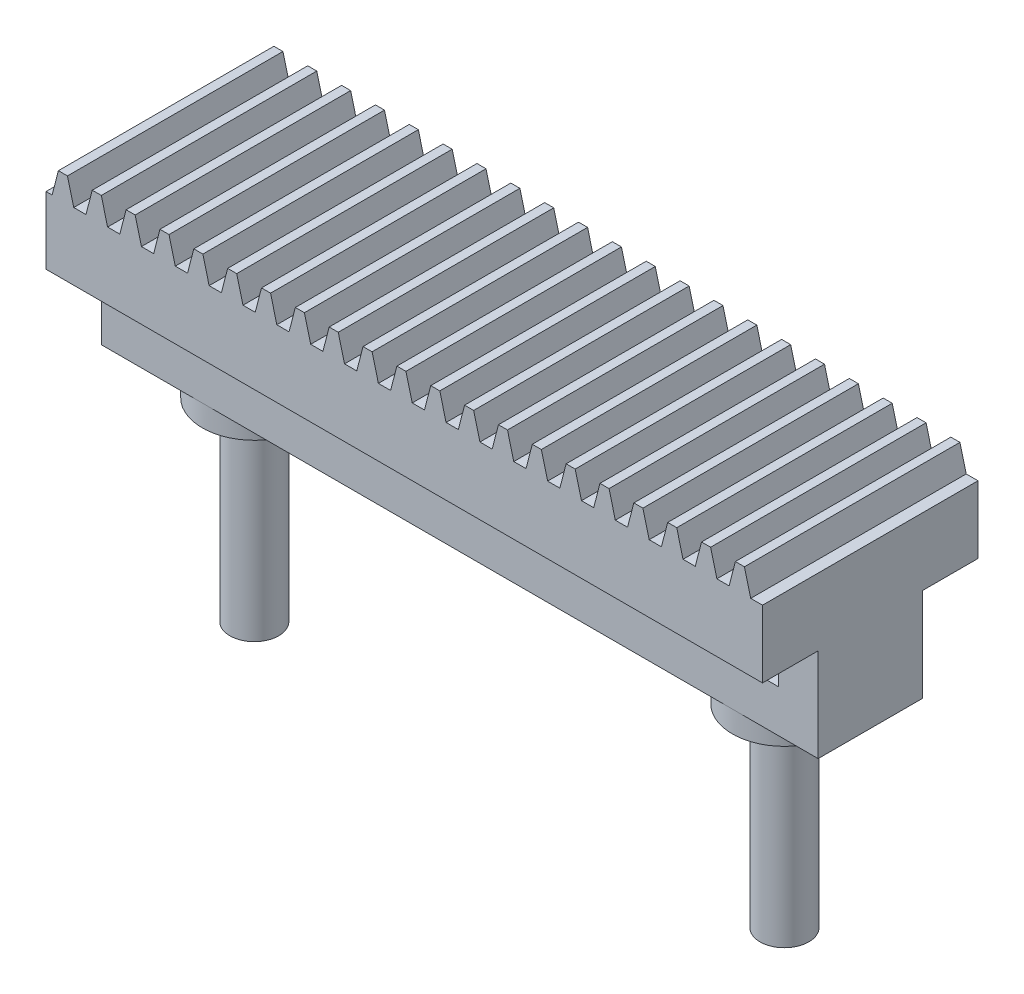
from build123d import *

# Parameters (mm, degrees)
BLANKSKE_W                 = 100
BLANKSKE_H                 = 12.75
BLANK_DEPTH                = 20
TOOTHCUTSIM_DEPTH          = 103.77432802
TEETHCUTS_COUNT            = 22
TEETHCUTS_PITCH            = 4.712388975
SALIENTE_EXTRUIR1_DEPTH    = 10
CORTAR_EXTRUIR1_DEPTH      = 103.77432802
CORTAR_EXTRUIR1_DEPTH_BACK = 0.25
CROQUIS12_W                = 30
CROQUIS12_H                = 10.100558753
CROQUIS13_W                = 99.75
CROQUIS13_H                = 14.5
SALIENTE_EXTRUIR6_DEPTH    = 13
CROQUIS14_R                = 7.25
CROQUIS14_R_2              = 3.4
SALIENTE_EXTRUIR7_DEPTH    = 3
CROQUIS15_R                = 3.4
SALIENTE_EXTRUIR8_DEPTH    = 30
CORTAR_EXTRUIR2_DEPTH      = 111.878875355
CORTAR_EXTRUIR2_DEPTH_BACK = 111.878875355
CROQUIS16_W                = 6.2
CROQUIS16_H                = 3.2


with BuildPart() as part:
    # BlankSke → Blank (new body)
    with BuildSketch(Plane.XY):
        with Locations((50, 6.375)):
            Rectangle(BLANKSKE_W, BLANKSKE_H)
    extrude(amount=-BLANK_DEPTH)

    # TooCutSkeSim → ToothCutSim (cut, through all)
    with BuildSketch(Plane.XY):
        Polygon((0.852189273, 9.375), (-0.852189273, 9.375), (-1.731592507, 12.7754), (1.731592507, 12.7754), align=None)
    toothcutsim = extrude(amount=-TOOTHCUTSIM_DEPTH, mode=Mode.SUBTRACT)

    # TeethCuts: ToothCutSim ×22
    with Locations(*[(i * TEETHCUTS_PITCH, 0, 0) for i in range(1, TEETHCUTS_COUNT)]):
        add(toothcutsim, mode=Mode.SUBTRACT)

    # Croquis1 → Saliente-Extruir1 (add)
    with BuildSketch(Plane.XY):
        Polygon((99.812357748, 9.375), (98.107979202, 9.375), (97.235144855, 12.75), (95.97280312, 12.75), (95.099968773, 9.375), (93.395590227, 9.375), (92.52275588, 12.75), (91.260414145, 12.75), (90.387579798, 9.375), (88.683201252, 9.375), (87.810366905, 12.75), (86.54802517, 12.75), (85.675190823, 9.375), (83.970812277, 9.375), (83.09797793, 12.75), (81.835636195, 12.75), (80.962801848, 9.375), (79.258423302, 9.375), (78.385588955, 12.75), (77.12324722, 12.75), (76.250412873, 9.375), (74.546034327, 9.375), (73.67319998, 12.75), (72.410858245, 12.75), (71.538023898, 9.375), (69.833645352, 9.375), (68.960811005, 12.75), (67.69846927, 12.75), (66.825634923, 9.375), (65.121256377, 9.375), (64.24842203, 12.75), (62.986080295, 12.75), (62.113245948, 9.375), (60.408867402, 9.375), (59.536033055, 12.75), (58.27369132, 12.75), (57.400856973, 9.375), (55.696478427, 9.375), (54.82364408, 12.75), (53.561302345, 12.75), (52.688467998, 9.375), (50.984089452, 9.375), (50.111255105, 12.75), (48.84891337, 12.75), (47.976079023, 9.375), (46.271700477, 9.375), (45.39886613, 12.75), (44.136524395, 12.75), (43.263690048, 9.375), (41.559311502, 9.375), (40.686477155, 12.75), (39.42413542, 12.75), (38.551301073, 9.375), (36.846922527, 9.375), (35.97408818, 12.75), (34.711746445, 12.75), (33.838912098, 9.375), (32.134533552, 9.375), (31.261699205, 12.75), (29.99935747, 12.75), (29.126523123, 9.375), (27.422144577, 9.375), (26.54931023, 12.75), (25.286968495, 12.75), (24.414134148, 9.375), (22.709755602, 9.375), (21.836921255, 12.75), (20.57457952, 12.75), (19.701745173, 9.375), (17.997366627, 9.375), (17.12453228, 12.75), (15.862190545, 12.75), (14.989356198, 9.375), (13.284977652, 9.375), (12.412143305, 12.75), (11.14980157, 12.75), (10.276967223, 9.375), (8.572588677, 9.375), (7.69975433, 12.75), (6.437412595, 12.75), (5.564578248, 9.375), (3.860199702, 9.375), (2.987365355, 12.75), (1.72502362, 12.75), (0.852189273, 9.375), (0, 9.375), (0, 0), (100, 0), (100, 10.100558753), align=None)
    extrude(amount=SALIENTE_EXTRUIR1_DEPTH)

    # Croquis12 → Cortar-Extruir1 (cut, two sides: drawn at the far end of the back side and taken through both)
    with BuildSketch(Plane(origin=(100, 0, 0), x_dir=(0, 0, -1), z_dir=(1, 0, 0)).offset(-CORTAR_EXTRUIR1_DEPTH_BACK)):
        with Locations((5, 5.050279377)):
            Rectangle(CROQUIS12_W, CROQUIS12_H)
    extrude(amount=CORTAR_EXTRUIR1_DEPTH + CORTAR_EXTRUIR1_DEPTH_BACK, mode=Mode.SUBTRACT)

    # Croquis13 → Saliente-Extruir6 (add)
    with BuildSketch(Plane.XZ):
        with Locations((49.875, -5)):
            Rectangle(CROQUIS13_W, CROQUIS13_H)
    extrude(amount=SALIENTE_EXTRUIR6_DEPTH)

    # Croquis14 → Saliente-Extruir7 (add)
    # profile 1 of 2: a face of its own
    with BuildSketch(Plane.XZ.offset(13)):
        with Locations(Location((14, -5, 0), (0, 0, 270))):
            Circle(CROQUIS14_R)
        with Locations(Location((14, -5, 0), (0, 0, 270))):
            Circle(CROQUIS14_R_2, mode=Mode.SUBTRACT)
    # profile 2 of 2: a face of its own
    with BuildSketch(Plane.XZ.offset(13)):
        with Locations(Location((87.8, -5, 0), (0, 0, 270))):
            Circle(CROQUIS14_R)
        with Locations(Location((87.8, -5, 0), (0, 0, 270))):
            Circle(CROQUIS14_R_2, mode=Mode.SUBTRACT)
    extrude(amount=SALIENTE_EXTRUIR7_DEPTH)

    # Croquis15 → Saliente-Extruir8 (add)
    with BuildSketch(Plane.XZ.offset(13)):
        with Locations(Location((87.8, -5, 0), (0, 0, 270))):
            Circle(CROQUIS15_R)
        with Locations(Location((14, -5, 0), (0, 0, 270))):
            Circle(CROQUIS15_R)
    extrude(amount=SALIENTE_EXTRUIR8_DEPTH)

    # Croquis16 → Cortar-Extruir2 (cut, two sides: drawn at the far end of the back side and taken through both)
    with BuildSketch(Plane.XY.offset(2.25).offset(-CORTAR_EXTRUIR2_DEPTH_BACK)):
        with Locations((43.1, -5.5)):
            Rectangle(CROQUIS16_W, CROQUIS16_H)
        with Locations((31.1, -5.5)):
            Rectangle(CROQUIS16_W, CROQUIS16_H)
        with Locations((55.1, -5.5)):
            Rectangle(CROQUIS16_W, CROQUIS16_H)
        with Locations((67.1, -5.5)):
            Rectangle(CROQUIS16_W, CROQUIS16_H)
        with Locations((79.1, -5.5)):
            Rectangle(CROQUIS16_W, CROQUIS16_H)
        with Locations((91.1, -5.5)):
            Rectangle(CROQUIS16_W, CROQUIS16_H)
    extrude(amount=CORTAR_EXTRUIR2_DEPTH + CORTAR_EXTRUIR2_DEPTH_BACK, mode=Mode.SUBTRACT)


solid = part.part
